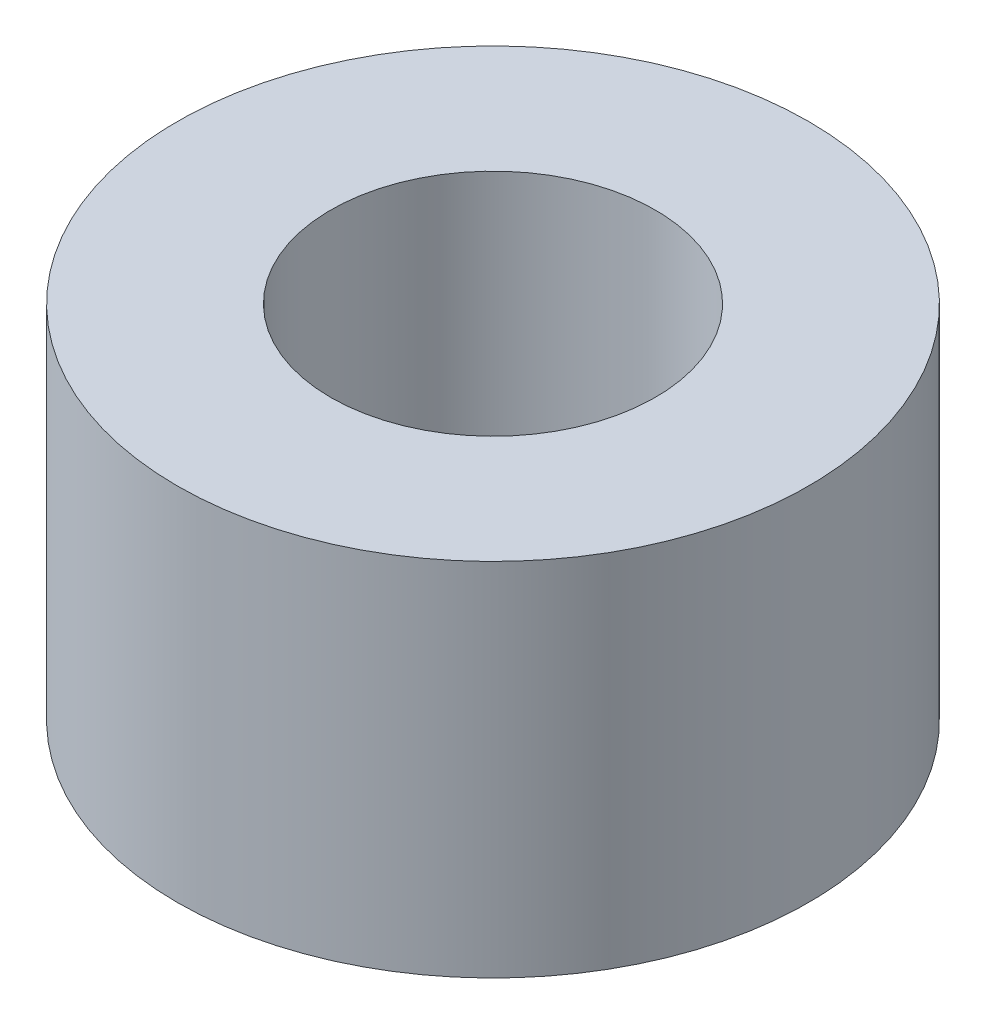
from build123d import *

# Parameters (mm, degrees)
SKETCH1_R           = 3.5
SKETCH1_R_2         = 1.8
BOSS_EXTRUDE1_DEPTH = 4


with BuildPart() as part:
    # Sketch1 → Boss-Extrude1 (new body)
    with BuildSketch(Plane(origin=(0, 0, 0), x_dir=(1, 0, 0), z_dir=(0, 1, 0))):
        with Locations(Location((0, 0, 0), (0, 0, 270))):
            Circle(SKETCH1_R)
        with Locations(Location((0, 0, 0), (0, 0, 270))):
            Circle(SKETCH1_R_2, mode=Mode.SUBTRACT)
    extrude(amount=BOSS_EXTRUDE1_DEPTH)


solid = part.part
